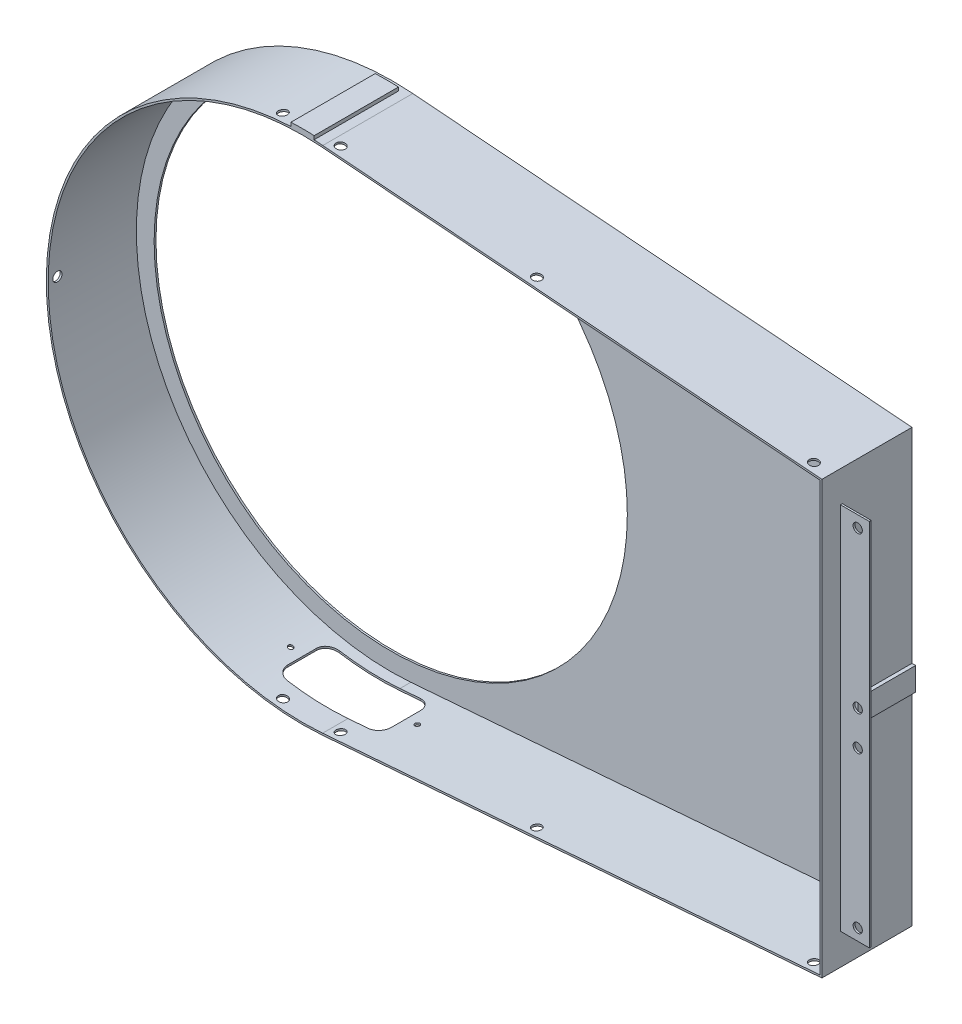
from build123d import *

# Parameters (mm, degrees)
SKETCH_1_R               = 222
EXTRUDE_1_DEPTH          = 76.4
EXTRUDE_2_DEPTH          = 76.4
CUT_EXTRUDE_1_DEPTH      = 508.563749691
CUT_EXTRUDE_1_DEPTH_BACK = 508.563749691
SKETCH_3_R               = 220.4
CUT_EXTRUDE_2_DEPTH      = 508.563749691
CUT_EXTRUDE_2_DEPTH_BACK = 508.563749691
SKETCH_5_R               = 222
EXTRUDE_3_DEPTH          = 1.6
EXTRUDE_4_DEPTH          = 1.6
CUT_EXTRUDE_3_DEPTH      = 508.807049971
CUT_EXTRUDE_3_DEPTH_BACK = 508.807049971
SKETCH_7_R               = 205
SKETCH_8_W               = 25
SKETCH_8_H               = 320
EXTRUDE_5_DEPTH          = 1.6
SKETCH_9_W               = 3.2
SKETCH_9_H               = 20
EXTRUDE_6_DEPTH          = 50
EXTRUDE_7_DEPTH          = 73
SKETCH_19_W              = 40
SKETCH_19_H              = 4
SKETCH_21_R              = 4
CUT_EXTRUDE_5_DEPTH      = 62
CUT_EXTRUDE_6_DEPTH      = 240


with BuildPart() as part:
    # ｽｹｯﾁ1 → ﾎﾞｽ - 押し出し1 (new body)
    with BuildSketch(Plane.XY.offset(1.6)):
        Circle(SKETCH_1_R)
    extrude(amount=EXTRUDE_1_DEPTH)

    # ｽｹｯﾁ2 → ﾎﾞｽ - 押し出し2 (add)
    with BuildSketch(Plane.XY.offset(1.6)):
        Polygon((17.508293028, 221.308516951), (450, 187.092971873), (450, -187.092971873), (17.508293028, -221.308516951), align=None)
    extrude(amount=EXTRUDE_2_DEPTH)

    # ｽｹｯﾁ3 → ｶｯﾄ - 押し出し1 (cut, two sides: drawn at the far end of the back side and taken through both)
    with BuildSketch(Plane.XY.offset(1.6).offset(-CUT_EXTRUDE_1_DEPTH_BACK)):
        Circle(SKETCH_3_R)
    extrude(amount=CUT_EXTRUDE_1_DEPTH + CUT_EXTRUDE_1_DEPTH_BACK, mode=Mode.SUBTRACT)

    # ｽｹｯﾁ4 → ｶｯﾄ - 押し出し2 (cut, two sides: drawn at the far end of the back side and taken through both)
    with BuildSketch(Plane.XY.offset(1.6).offset(-CUT_EXTRUDE_2_DEPTH_BACK)):
        Polygon((17.382107132, 219.713500613), (448.4, 185.614552806), (448.4, -185.614552806), (17.382107132, -219.713500613), align=None)
    extrude(amount=CUT_EXTRUDE_2_DEPTH + CUT_EXTRUDE_2_DEPTH_BACK, mode=Mode.SUBTRACT)

    # ｽｹｯﾁ5 → ﾎﾞｽ - 押し出し3 (add)
    with BuildSketch(Plane.XY):
        with Locations(Location((0, 0, 0), (0, 0, 274.523396987))):
            Circle(SKETCH_5_R)
    extrude(amount=EXTRUDE_3_DEPTH)

    # ｽｹｯﾁ6 → ﾎﾞｽ - 押し出し4 (add)
    with BuildSketch(Plane.XY):
        Polygon((17.508293028, 221.308516951), (450, 187.092971873), (450, -187.092971873), (17.508293028, -221.308516951), align=None)
    extrude(amount=EXTRUDE_4_DEPTH)

    # ｽｹｯﾁ7 → ｶｯﾄ - 押し出し3 (cut, two sides: drawn at the far end of the back side and taken through both)
    with BuildSketch(Plane.XY.offset(-CUT_EXTRUDE_3_DEPTH_BACK)):
        Circle(SKETCH_7_R)
    extrude(amount=CUT_EXTRUDE_3_DEPTH + CUT_EXTRUDE_3_DEPTH_BACK, mode=Mode.SUBTRACT)

    # ｽｹｯﾁ8 → ﾎﾞｽ - 押し出し5 (add)
    with BuildSketch(Plane.XY.offset(60.4)):
        with Locations((462.5, 0)):
            Rectangle(SKETCH_8_W, SKETCH_8_H)
    extrude(amount=EXTRUDE_5_DEPTH)

    # ｽｹｯﾁ9 → ﾎﾞｽ - 押し出し6 (add)
    with BuildSketch(Plane.XY):
        with Locations((451.6, 0)):
            Rectangle(SKETCH_9_W, SKETCH_9_H)
    extrude(amount=EXTRUDE_6_DEPTH)

    # ｽｹｯﾁ10 → ﾎﾞｽ - 押し出し7 (add)
    with BuildSketch(Plane.XY.offset(5)):
        with BuildLine():
            Line((9.925134298, 221.778023504), (10.068199297, 224.974823842))
            ThreePointArc((10.068199297, 224.974823842), (0, 225.2), (-10.068199297, 224.974823842))
            Line((-10.068199297, 224.974823842), (-9.925134298, 221.778023504))
            ThreePointArc((-9.925134298, 221.778023504), (0, 222), (9.925134298, 221.778023504))
        make_face()
    extrude(amount=EXTRUDE_7_DEPTH)

    # ｽｹｯﾁ11 → ｶｯﾄ - 回転1 (revolve, cut)
    with BuildSketch(Plane.XY.offset(70), mode=Mode.PRIVATE) as cut_revolve_1_sk:
        Polygon((-22.73960217, 199.910856366), (-27.26039783, 239.654565386), (-31.234768732, 239.20248582), (-26.713973072, 199.4587768), align=None)
    revolve(cut_revolve_1_sk.sketch.rotate(Axis((-22.73960217, 199.910856366, 70), (-0.11301989150090416, 0.9935927254791693, 0)), 180), axis=Axis((-22.73960217, 199.910856366, 70), (-0.11301989150090416, 0.9935927254791693, 0)), mode=Mode.SUBTRACT)

    # ｽｹｯﾁ12 → ｶｯﾄ - 回転2 (revolve, cut)
    with BuildSketch(Plane.XY.offset(70), mode=Mode.PRIVATE) as cut_revolve_2_sk:
        Polygon((23.422676304, 199.975624659), (26.577323696, 239.851033119), (22.58978285, 240.166497858), (19.435135458, 200.291089398), align=None)
    revolve(cut_revolve_2_sk.sketch.rotate(Axis((23.422676304, 199.975624659, 70), (0.07886618481164225, 0.996885211492906, 0)), 180), axis=Axis((23.422676304, 199.975624659, 70), (0.07886618481164225, 0.996885211492906, 0)), mode=Mode.SUBTRACT)

    # ｽｹｯﾁ13 → ｶｯﾄ - 回転3 (revolve, cut)
    with BuildSketch(Plane.XY.offset(70), mode=Mode.PRIVATE) as cut_revolve_3_sk:
        Polygon((193.422676304, 186.526482006), (196.577323696, 226.401890466), (192.58978285, 226.717355205), (189.435135458, 186.841946746), align=None)
    revolve(cut_revolve_3_sk.sketch.rotate(Axis((193.422676304, 186.526482006, 70), (0.078866184811642, 0.9968852114929061, 0)), 180), axis=Axis((193.422676304, 186.526482006, 70), (0.078866184811642, 0.9968852114929061, 0)), mode=Mode.SUBTRACT)

    # ｽｹｯﾁ14 → ｶｯﾄ - 回転4 (revolve, cut)
    with BuildSketch(Plane.XY.offset(70), mode=Mode.PRIVATE) as cut_revolve_4_sk:
        Polygon((433.422676304, 167.539457084), (436.577323696, 207.414865544), (432.58978285, 207.730330283), (429.435135458, 167.854921824), align=None)
    revolve(cut_revolve_4_sk.sketch.rotate(Axis((433.422676304, 167.539457084, 70), (0.07886618481164205, 0.9968852114929061, 0)), 180), axis=Axis((433.422676304, 167.539457084, 70), (0.07886618481164205, 0.9968852114929061, 0)), mode=Mode.SUBTRACT)

    # ｽｹｯﾁ15 → ｶｯﾄ - 回転5 (revolve, cut)
    with BuildSketch(Plane.XY.offset(70), mode=Mode.PRIVATE) as cut_revolve_5_sk:
        Polygon((-22.73960217, -199.910856366), (-27.26039783, -239.654565386), (-23.286026928, -240.106644952), (-18.765231268, -200.362935932), align=None)
    revolve(cut_revolve_5_sk.sketch.rotate(Axis((-22.73960217, -199.910856366, 70), (-0.11301989150090416, -0.9935927254791693, 0)), 180), axis=Axis((-22.73960217, -199.910856366, 70), (-0.11301989150090416, -0.9935927254791693, 0)), mode=Mode.SUBTRACT)

    # ｽｹｯﾁ16 → ｶｯﾄ - 回転6 (revolve, cut)
    with BuildSketch(Plane.XY.offset(70), mode=Mode.PRIVATE) as cut_revolve_6_sk:
        Polygon((23.422676304, -199.975624659), (26.577323696, -239.851033119), (30.564864542, -239.53556838), (27.41021715, -199.66015992), align=None)
    revolve(cut_revolve_6_sk.sketch.rotate(Axis((23.422676304, -199.975624659, 70), (0.07886618481164225, -0.996885211492906, 0)), 180), axis=Axis((23.422676304, -199.975624659, 70), (0.07886618481164225, -0.996885211492906, 0)), mode=Mode.SUBTRACT)

    # ｽｹｯﾁ17 → ｶｯﾄ - 回転7 (revolve, cut)
    with BuildSketch(Plane.XY.offset(70), mode=Mode.PRIVATE) as cut_revolve_7_sk:
        Polygon((193.422676304, -186.526482006), (196.577323696, -226.401890466), (200.564864542, -226.086425727), (197.41021715, -186.211017267), align=None)
    revolve(cut_revolve_7_sk.sketch.rotate(Axis((193.422676304, -186.526482006, 70), (0.078866184811642, -0.9968852114929061, 0)), 180), axis=Axis((193.422676304, -186.526482006, 70), (0.078866184811642, -0.9968852114929061, 0)), mode=Mode.SUBTRACT)

    # ｽｹｯﾁ18 → ｶｯﾄ - 回転8 (revolve, cut)
    with BuildSketch(Plane.XY.offset(70), mode=Mode.PRIVATE) as cut_revolve_8_sk:
        Polygon((433.422676304, -167.539457084), (436.577323696, -207.414865544), (440.564864542, -207.099400805), (437.41021715, -167.223992345), align=None)
    revolve(cut_revolve_8_sk.sketch.rotate(Axis((433.422676304, -167.539457084, 70), (0.07886618481164205, -0.9968852114929061, 0)), 180), axis=Axis((433.422676304, -167.539457084, 70), (0.07886618481164205, -0.9968852114929061, 0)), mode=Mode.SUBTRACT)

    # ｽｹｯﾁ19 → ｶｯﾄ - 回転9 (revolve, cut)
    with BuildSketch(Plane.XY.offset(70), mode=Mode.PRIVATE) as cut_revolve_9_sk:
        with Locations((-221.2, -2)):
            Rectangle(SKETCH_19_W, SKETCH_19_H)
    revolve(cut_revolve_9_sk.sketch.rotate(Axis((-201.2, 0, 70), (-1, 0, 0)), 270), axis=Axis((-201.2, 0, 70), (-1, 0, 0)), mode=Mode.SUBTRACT)

    # ｽｹｯﾁ21 → ｶｯﾄ - 押し出し5 (cut)
    with BuildSketch(Plane.XY):
        with Locations((465, -150)):
            Circle(SKETCH_21_R)
        with Locations((465, -15)):
            Circle(SKETCH_21_R)
        with Locations((465, 15)):
            Circle(SKETCH_21_R)
        with Locations((465, 150)):
            Circle(SKETCH_21_R)
    extrude(amount=CUT_EXTRUDE_5_DEPTH, mode=Mode.SUBTRACT)

    # ｽｹｯﾁ22 → ｶｯﾄ - 押し出し6 (cut)
    with BuildSketch(Plane(origin=(0, 0, 0), x_dir=(1, 0, 0), z_dir=(0, 1, 0))):
        with BuildLine():
            Line((-35, -56), (35, -56))
            ThreePointArc((35, -56), (42.071067812, -53.071067812), (45, -46))
            Line((45, -46), (45, -21))
            ThreePointArc((45, -21), (42.071067812, -13.928932188), (35, -11))
            Line((35, -11), (-35, -11))
            ThreePointArc((-35, -11), (-42.071067812, -13.928932188), (-45, -21))
            Line((-45, -21), (-45, -46))
            ThreePointArc((-45, -46), (-42.071067812, -53.071067812), (-35, -56))
        make_face()
    extrude(amount=-CUT_EXTRUDE_6_DEPTH, mode=Mode.SUBTRACT)

    # ｽｹｯﾁ23 → ｶｯﾄ - 回転10 (revolve, cut)
    with BuildSketch(Plane.XY.offset(33.5), mode=Mode.PRIVATE) as cut_revolve_10_sk:
        Polygon((-50.027124774, -194.881314617), (-59.972875226, -233.62511474), (-57.93882572, -234.147266638), (-47.993075268, -195.403466516), align=None)
    revolve(cut_revolve_10_sk.sketch.rotate(Axis((-50.027124774, -194.881314617, 33.5), (-0.24864376130198912, -0.9685950030666065, 0)), 180), axis=Axis((-50.027124774, -194.881314617, 33.5), (-0.24864376130198912, -0.9685950030666065, 0)), mode=Mode.SUBTRACT)

    # ｽｹｯﾁ24 → ｶｯﾄ - 回転11 (revolve, cut)
    with BuildSketch(Plane.XY.offset(33.5), mode=Mode.PRIVATE) as cut_revolve_11_sk:
        Polygon((53.422676304, -197.602246544), (56.577323696, -237.477655004), (58.67078264, -237.312036016), (55.516135248, -197.436627556), align=None)
    revolve(cut_revolve_11_sk.sketch.rotate(Axis((53.422676304, -197.602246544, 33.5), (0.07886618481164233, -0.996885211492906, 0)), 180), axis=Axis((53.422676304, -197.602246544, 33.5), (0.07886618481164233, -0.996885211492906, 0)), mode=Mode.SUBTRACT)


solid = part.part
